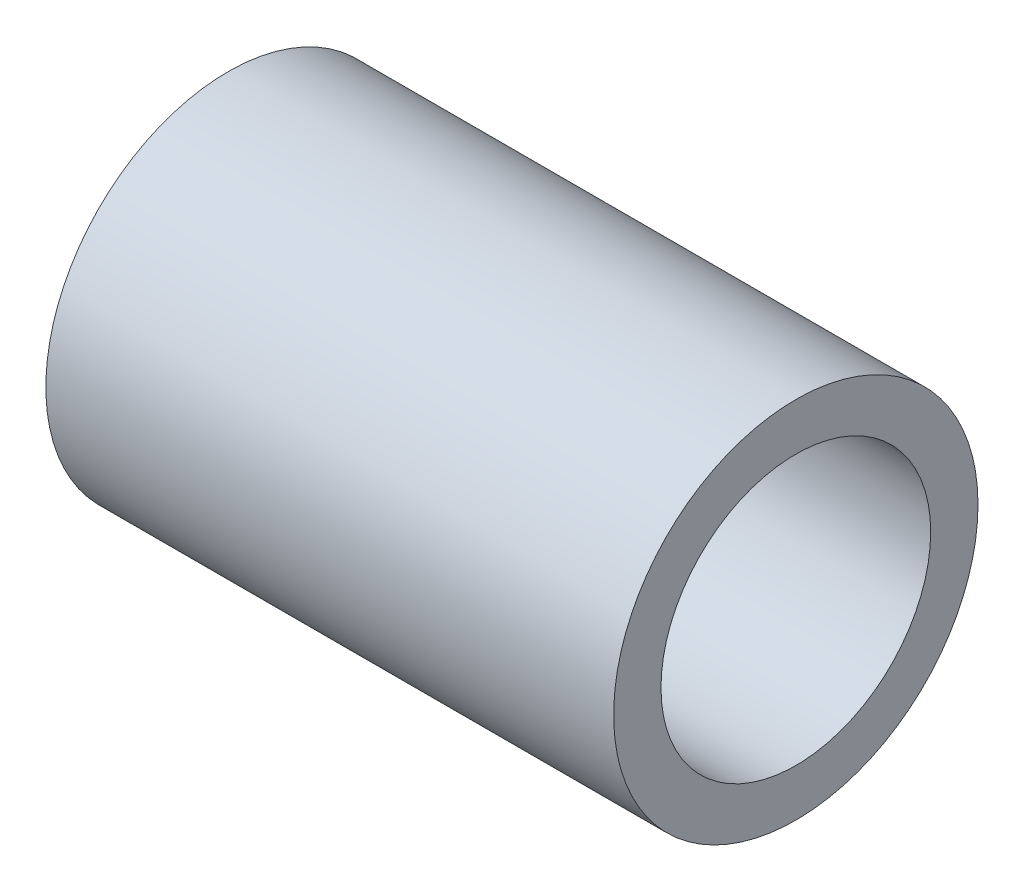
from build123d import *

# Parameters (mm, degrees)
SKETCH1_R           = 11.55
SKETCH1_R_2         = 8.55
BOSS_EXTRUDE1_DEPTH = 12
BOSS_EXTRUDE2_DEPTH = 4
SKETCH3_R           = 11.55
SKETCH3_R_2         = 8.55
BOSS_EXTRUDE3_DEPTH = 4
SKETCH4_R           = 11.55
SKETCH4_R_2         = 8.55
BOSS_EXTRUDE4_DEPTH = 20


with BuildPart() as part:
    # Sketch1 → Boss-Extrude1 (new body)
    with BuildSketch(Plane(origin=(0, 0, 0), x_dir=(0, 0, -1), z_dir=(1, 0, 0))):
        Circle(SKETCH1_R)
        Circle(SKETCH1_R_2, mode=Mode.SUBTRACT)
    extrude(amount=BOSS_EXTRUDE1_DEPTH)



with BuildPart() as body_2:
    # Sketch2 → Boss-Extrude2 (new body)
    with BuildSketch(Plane(origin=(12, 0, 0), x_dir=(0, 0, -1), z_dir=(1, 0, 0))):
        with BuildLine():
            Line((-3.65, 7.731752712), (-3.65, -7.731752712))
            ThreePointArc((-3.65, -7.731752712), (0, -8.55), (3.65, -7.731752712))
            Line((3.65, -7.731752712), (3.65, 7.731752712))
            ThreePointArc((3.65, 7.731752712), (0, 8.55), (-3.65, 7.731752712))
        make_face()
    extrude(amount=BOSS_EXTRUDE2_DEPTH)


with BuildPart() as part_1:
    add(part.part)

    add(body_2.part)  # Boss-Extrude3 merges body 2
    # Sketch3 → Boss-Extrude3 (add)
    with BuildSketch(Plane(origin=(12, 0, 0), x_dir=(0, 0, -1), z_dir=(1, 0, 0))):
        Circle(SKETCH3_R)
        with Locations(Location((0, 0, 0), (0, 0, 244.72897634))):
            Circle(SKETCH3_R_2, mode=Mode.SUBTRACT)
    extrude(amount=BOSS_EXTRUDE3_DEPTH)

    # Sketch4 → Boss-Extrude4 (add)
    with BuildSketch(Plane(origin=(16, 0, 0), x_dir=(0, 0, -1), z_dir=(1, 0, 0))):
        Circle(SKETCH4_R)
        Circle(SKETCH4_R_2, mode=Mode.SUBTRACT)
    extrude(amount=BOSS_EXTRUDE4_DEPTH)


solid = part_1.part
